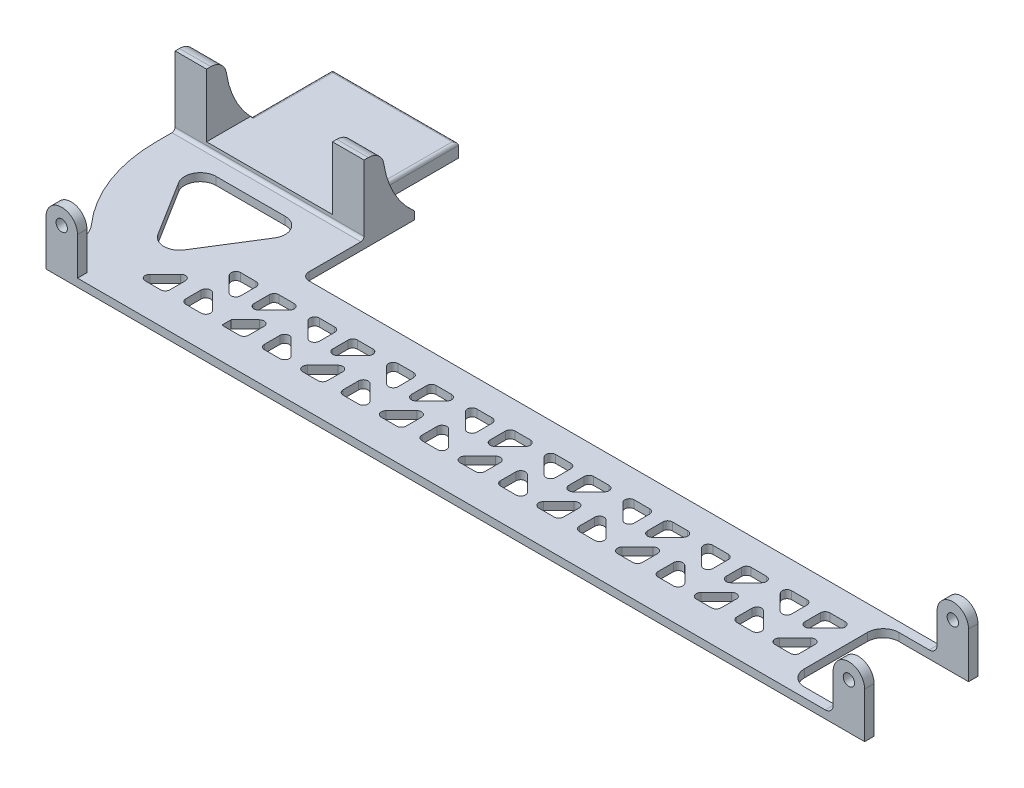
from build123d import *

# Parameters (mm, degrees)
EXTRUDE_2_DEPTH           = 18
SKETCH_3_W                = 10
SKETCH_3_H                = 16
EXTRUDE_3_DEPTH           = 22
EXTRUDE_3_2_DEPTH         = 22
CUT_EXTRUDE_2_DEPTH       = 60
FILLET_1_R                = 5
FILLET_2_R                = 5
EXTRUDE_4_DEPTH           = 2
FILLET_3_R                = 1
EXTRUDE_5_DEPTH           = 2.5
CUT_EXTRUDE_10_DEPTH      = 167.111408532
CUT_EXTRUDE_10_DEPTH_BACK = 167.111408532
FILLET_4_R                = 1
FILLET_5_R                = 2.5
FILLET_6_R                = 2.5
EXTRUDE_6_DEPTH           = 3
SKETCH_14_W               = 10
SKETCH_14_H               = 3
EXTRUDE_7_DEPTH           = 2.5
FILLET_7_R                = 10


with BuildPart() as part:
    # 草图2 → 凸台-拉伸2 (new, symmetric)
    with BuildSketch(Plane.XY):
        with BuildLine():
            ThreePointArc((130, 12), (125, 17), (120, 12))
            Line((120, 12), (123.2, 12))
            ThreePointArc((123.2, 12), (125, 13.8), (126.8, 12))
            Line((126.8, 12), (130, 12))
        make_face()
        with BuildLine():
            Line((123.2, 12), (120, 12))
            ThreePointArc((120, 12), (125, 7), (130, 12))
            Line((130, 12), (126.8, 12))
            ThreePointArc((126.8, 12), (125, 10.2), (123.2, 12))
        make_face()
        with BuildLine():
            Line((120, 12), (120, 0))
            Line((120, 0), (125, 0))
            Line((125, 0), (130, 0))
            Line((130, 0), (130, 12))
            ThreePointArc((130, 12), (125, 7), (120, 12))
        make_face()
    extrude(amount=EXTRUDE_2_DEPTH, both=True)



with BuildPart() as body_2:
    # 草图3 → 凸台-拉伸3 (new body)
    with BuildSketch(Plane(origin=(0, 0, 0), x_dir=(1, 0, 0), z_dir=(0, 1, 0))):
        with Locations((-90, 46)):
            Rectangle(SKETCH_3_W, SKETCH_3_H)
    extrude(amount=EXTRUDE_3_DEPTH)


with BuildPart() as body_3:
    # 草图3 → Extrude 3 2 (new body)
    with BuildSketch(Plane(origin=(0, 0, 0), x_dir=(1, 0, 0), z_dir=(0, 1, 0))):
        with Locations((-140, 46)):
            Rectangle(SKETCH_3_W, SKETCH_3_H)
    extrude(amount=EXTRUDE_3_2_DEPTH)


with BuildPart() as cut_extrude_2_tool:
    # 草图7 → 切除-拉伸2 (new body)
    with BuildSketch(Plane.ZY.offset(145)):
        with BuildLine():
            Line((-54, 22), (-54, 0))
            ThreePointArc((-54, 0), (-46.617298858, 9.916954026), (-44, 22))
            Line((-44, 22), (-54, 22))
        make_face()
    extrude(amount=-CUT_EXTRUDE_2_DEPTH)


with BuildPart() as body_2_1:
    add(body_2.part)

    # 切除-拉伸2: cut by cut_extrude_2_tool
    add(cut_extrude_2_tool.part, mode=Mode.SUBTRACT)

    # 圆角2
    fillet_2_edges = [body_2_1.edges().sort_by_distance(p)[0] for p in [
        (-90, 22, -44),
    ]]
    fillet(fillet_2_edges, radius=FILLET_2_R)



with BuildPart() as body_3_1:
    add(body_3.part)

    # 切除-拉伸2: cut by cut_extrude_2_tool
    add(cut_extrude_2_tool.part, mode=Mode.SUBTRACT)

    # 圆角1
    fillet_1_edges = [body_3_1.edges().sort_by_distance(p)[0] for p in [
        (-140, 22, -44),
    ]]
    fillet(fillet_1_edges, radius=FILLET_1_R)


with BuildPart() as body_2_2:
    add(body_2_1.part)

    add(body_3_1.part)  # 凸台-拉伸4 merges body 3
    # 草图10 → 凸台-拉伸4 (add)
    with BuildSketch(Plane(origin=(0, 0, 0), x_dir=(1, 0, 0), z_dir=(0, 1, 0))):
        Polygon((-95, 38), (-95, 54), (-95, 78), (-135, 78), (-135, 54), (-135, 38), align=None)
    extrude(amount=EXTRUDE_4_DEPTH)

    # 圆角3
    fillet_3_edges = [body_2_2.edges().sort_by_distance(p)[0] for p in [
        (-95, 2, -64.962331082),
        (-115, 2, -78),
        (-135, 2, -64.962331082),
    ]]
    fillet(fillet_3_edges, radius=FILLET_3_R)


with BuildPart() as part_1:
    add(part.part)

    add(body_2_2.part)  # 凸台-拉伸5 merges body 2
    # 草图11 → 凸台-拉伸5 (add)
    with BuildSketch(Plane(origin=(0, 0, 0), x_dir=(1, 0, 0), z_dir=(0, 1, 0))):
        with BuildLine():
            Line((120, -18), (-95, -18))
            ThreePointArc((-95, -18), (-130.355339059, -3.355339059), (-145, 32))
            Line((-145, 32), (-145, 38))
            Line((-145, 38), (-145, 54))
            Line((-145, 54), (-135, 54))
            Line((-135, 54), (-135, 78))
            Line((-135, 78), (-95, 78))
            Line((-95, 78), (-95, 54))
            Line((-95, 54), (-85, 54))
            Line((-85, 54), (-85, 38))
            Line((-85, 38), (-85, 18))
            Line((-85, 18), (120, 18))
            Line((120, 18), (130, 18))
            Line((130, 18), (130, -18))
            Line((130, -18), (120, -18))
        make_face()
        with BuildLine():
            Line((-104.021238208, 32), (-125.978761792, 32))
            ThreePointArc((-125.978761792, 32), (-130.351974199, 29.423842662), (-130.218753312, 24.3500053))
            Line((-130.218753312, 24.3500053), (-119.23999152, 6.783986432))
            ThreePointArc((-119.23999152, 6.783986432), (-115, 4.433981132), (-110.76000848, 6.783986432))
            Line((-110.76000848, 6.783986432), (-99.781246688, 24.3500053))
            ThreePointArc((-99.781246688, 24.3500053), (-99.648025801, 29.423842662), (-104.021238208, 32))
        make_face(mode=Mode.SUBTRACT)
        with BuildLine():
            Line((-83.5, 9.433981132), (-78.621320344, 9.433981132))
            ThreePointArc((-78.621320344, 9.433981132), (-77.235501045, 8.508006281), (-77.560660172, 6.87332096))
            Line((-77.560660172, 6.87332096), (-82.439339828, 1.994641304))
            ThreePointArc((-82.439339828, 1.994641304), (-84.074025149, 1.669482177), (-85, 3.055301476))
            Line((-85, 3.055301476), (-85, 7.933981132))
            ThreePointArc((-85, 7.933981132), (-84.560660172, 8.994641304), (-83.5, 9.433981132))
        make_face(mode=Mode.SUBTRACT)
        with BuildLine():
            Line((-83.5, -8), (-78.621320344, -8))
            ThreePointArc((-78.621320344, -8), (-77.560660172, -7.560660172), (-77.121320344, -6.5))
            Line((-77.121320344, -6.5), (-77.121320344, -1.621320344))
            ThreePointArc((-77.121320344, -1.621320344), (-78.047295195, -0.235501045), (-79.681980515, -0.560660172))
            Line((-79.681980515, -0.560660172), (-84.560660172, -5.439339828))
            ThreePointArc((-84.560660172, -5.439339828), (-84.885819299, -7.074025149), (-83.5, -8))
        make_face(mode=Mode.SUBTRACT)
        with BuildLine():
            Line((-65.742640687, -8), (-70.621320344, -8))
            ThreePointArc((-70.621320344, -8), (-71.681980515, -7.560660172), (-72.121320344, -6.5))
            Line((-72.121320344, -6.5), (-72.121320344, -1.621320344))
            ThreePointArc((-72.121320344, -1.621320344), (-71.195345492, -0.235501045), (-69.560660172, -0.560660172))
            Line((-69.560660172, -0.560660172), (-64.681980515, -5.439339828))
            ThreePointArc((-64.681980515, -5.439339828), (-64.356821388, -7.074025149), (-65.742640687, -8))
        make_face(mode=Mode.SUBTRACT)
        with BuildLine():
            Line((-64.242640687, 3.055301476), (-64.242640687, 7.933981132))
            ThreePointArc((-64.242640687, 7.933981132), (-64.681980515, 8.994641304), (-65.742640687, 9.433981132))
            Line((-65.742640687, 9.433981132), (-70.621320344, 9.433981132))
            ThreePointArc((-70.621320344, 9.433981132), (-72.007139642, 8.508006281), (-71.681980515, 6.87332096))
            Line((-71.681980515, 6.87332096), (-66.803300859, 1.994641304))
            ThreePointArc((-66.803300859, 1.994641304), (-65.168615539, 1.669482177), (-64.242640687, 3.055301476))
        make_face(mode=Mode.SUBTRACT)
        with BuildLine():
            Line((-40.742640687, 9.433981132), (-45.621320344, 9.433981132))
            ThreePointArc((-45.621320344, 9.433981132), (-47.007139642, 8.508006281), (-46.681980515, 6.87332096))
            Line((-46.681980515, 6.87332096), (-41.803300859, 1.994641304))
            ThreePointArc((-41.803300859, 1.994641304), (-40.168615539, 1.669482177), (-39.242640687, 3.055301476))
            Line((-39.242640687, 3.055301476), (-39.242640687, 7.933981132))
            ThreePointArc((-39.242640687, 7.933981132), (-39.681980515, 8.994641304), (-40.742640687, 9.433981132))
        make_face(mode=Mode.SUBTRACT)
        with BuildLine():
            Line((-44.560660172, -0.560660172), (-39.681980515, -5.439339828))
            ThreePointArc((-39.681980515, -5.439339828), (-39.356821388, -7.074025149), (-40.742640687, -8))
            Line((-40.742640687, -8), (-45.621320344, -8))
            ThreePointArc((-45.621320344, -8), (-46.681980515, -7.560660172), (-47.121320344, -6.5))
            Line((-47.121320344, -6.5), (-47.121320344, -1.621320344))
            ThreePointArc((-47.121320344, -1.621320344), (-46.195345492, -0.235501045), (-44.560660172, -0.560660172))
        make_face(mode=Mode.SUBTRACT)
        with BuildLine():
            Line((-52.560660172, 6.87332096), (-57.439339828, 1.994641304))
            ThreePointArc((-57.439339828, 1.994641304), (-59.074025149, 1.669482177), (-60, 3.055301476))
            Line((-60, 3.055301476), (-60, 7.933981132))
            ThreePointArc((-60, 7.933981132), (-59.560660172, 8.994641304), (-58.5, 9.433981132))
            Line((-58.5, 9.433981132), (-53.621320344, 9.433981132))
            ThreePointArc((-53.621320344, 9.433981132), (-52.235501045, 8.508006281), (-52.560660172, 6.87332096))
        make_face(mode=Mode.SUBTRACT)
        with BuildLine():
            Line((-54.681980515, -0.560660172), (-59.560660172, -5.439339828))
            ThreePointArc((-59.560660172, -5.439339828), (-59.885819299, -7.074025149), (-58.5, -8))
            Line((-58.5, -8), (-53.621320344, -8))
            ThreePointArc((-53.621320344, -8), (-52.560660172, -7.560660172), (-52.121320344, -6.5))
            Line((-52.121320344, -6.5), (-52.121320344, -1.621320344))
            ThreePointArc((-52.121320344, -1.621320344), (-53.047295195, -0.235501045), (-54.681980515, -0.560660172))
        make_face(mode=Mode.SUBTRACT)
        with BuildLine():
            Line((-15.742640687, 9.433981132), (-20.621320344, 9.433981132))
            ThreePointArc((-20.621320344, 9.433981132), (-22.007139642, 8.508006281), (-21.681980515, 6.87332096))
            Line((-21.681980515, 6.87332096), (-16.803300859, 1.994641304))
            ThreePointArc((-16.803300859, 1.994641304), (-15.168615539, 1.669482177), (-14.242640687, 3.055301476))
            Line((-14.242640687, 3.055301476), (-14.242640687, 7.933981132))
            ThreePointArc((-14.242640687, 7.933981132), (-14.681980515, 8.994641304), (-15.742640687, 9.433981132))
        make_face(mode=Mode.SUBTRACT)
        with BuildLine():
            Line((-19.560660172, -0.560660172), (-14.681980515, -5.439339828))
            ThreePointArc((-14.681980515, -5.439339828), (-14.356821388, -7.074025149), (-15.742640687, -8))
            Line((-15.742640687, -8), (-20.621320344, -8))
            ThreePointArc((-20.621320344, -8), (-21.681980515, -7.560660172), (-22.121320344, -6.5))
            Line((-22.121320344, -6.5), (-22.121320344, -1.621320344))
            ThreePointArc((-22.121320344, -1.621320344), (-21.195345492, -0.235501045), (-19.560660172, -0.560660172))
        make_face(mode=Mode.SUBTRACT)
        with BuildLine():
            Line((-27.560660172, 6.87332096), (-32.439339828, 1.994641304))
            ThreePointArc((-32.439339828, 1.994641304), (-34.074025149, 1.669482177), (-35, 3.055301476))
            Line((-35, 3.055301476), (-35, 7.933981132))
            ThreePointArc((-35, 7.933981132), (-34.560660172, 8.994641304), (-33.5, 9.433981132))
            Line((-33.5, 9.433981132), (-28.621320344, 9.433981132))
            ThreePointArc((-28.621320344, 9.433981132), (-27.235501045, 8.508006281), (-27.560660172, 6.87332096))
        make_face(mode=Mode.SUBTRACT)
        with BuildLine():
            Line((-29.681980515, -0.560660172), (-34.560660172, -5.439339828))
            ThreePointArc((-34.560660172, -5.439339828), (-34.885819299, -7.074025149), (-33.5, -8))
            Line((-33.5, -8), (-28.621320344, -8))
            ThreePointArc((-28.621320344, -8), (-27.560660172, -7.560660172), (-27.121320344, -6.5))
            Line((-27.121320344, -6.5), (-27.121320344, -1.621320344))
            ThreePointArc((-27.121320344, -1.621320344), (-28.047295195, -0.235501045), (-29.681980515, -0.560660172))
        make_face(mode=Mode.SUBTRACT)
        with BuildLine():
            Line((9.257359313, 9.433981132), (4.378679656, 9.433981132))
            ThreePointArc((4.378679656, 9.433981132), (2.992860358, 8.508006281), (3.318019485, 6.87332096))
            Line((3.318019485, 6.87332096), (8.196699141, 1.994641304))
            ThreePointArc((8.196699141, 1.994641304), (9.831384461, 1.669482177), (10.757359313, 3.055301476))
            Line((10.757359313, 3.055301476), (10.757359313, 7.933981132))
            ThreePointArc((10.757359313, 7.933981132), (10.318019485, 8.994641304), (9.257359313, 9.433981132))
        make_face(mode=Mode.SUBTRACT)
        with BuildLine():
            Line((5.439339828, -0.560660172), (10.318019485, -5.439339828))
            ThreePointArc((10.318019485, -5.439339828), (10.643178612, -7.074025149), (9.257359313, -8))
            Line((9.257359313, -8), (4.378679656, -8))
            ThreePointArc((4.378679656, -8), (3.318019485, -7.560660172), (2.878679656, -6.5))
            Line((2.878679656, -6.5), (2.878679656, -1.621320344))
            ThreePointArc((2.878679656, -1.621320344), (3.804654508, -0.235501045), (5.439339828, -0.560660172))
        make_face(mode=Mode.SUBTRACT)
        with BuildLine():
            Line((-2.560660172, 6.87332096), (-7.439339828, 1.994641304))
            ThreePointArc((-7.439339828, 1.994641304), (-9.074025149, 1.669482177), (-10, 3.055301476))
            Line((-10, 3.055301476), (-10, 7.933981132))
            ThreePointArc((-10, 7.933981132), (-9.560660172, 8.994641304), (-8.5, 9.433981132))
            Line((-8.5, 9.433981132), (-3.621320344, 9.433981132))
            ThreePointArc((-3.621320344, 9.433981132), (-2.235501045, 8.508006281), (-2.560660172, 6.87332096))
        make_face(mode=Mode.SUBTRACT)
        with BuildLine():
            Line((-4.681980515, -0.560660172), (-9.560660172, -5.439339828))
            ThreePointArc((-9.560660172, -5.439339828), (-9.885819299, -7.074025149), (-8.5, -8))
            Line((-8.5, -8), (-3.621320344, -8))
            ThreePointArc((-3.621320344, -8), (-2.560660172, -7.560660172), (-2.121320344, -6.5))
            Line((-2.121320344, -6.5), (-2.121320344, -1.621320344))
            ThreePointArc((-2.121320344, -1.621320344), (-3.047295195, -0.235501045), (-4.681980515, -0.560660172))
        make_face(mode=Mode.SUBTRACT)
        with BuildLine():
            Line((34.257359313, 9.433981132), (29.378679656, 9.433981132))
            ThreePointArc((29.378679656, 9.433981132), (27.992860358, 8.508006281), (28.318019485, 6.87332096))
            Line((28.318019485, 6.87332096), (33.196699141, 1.994641304))
            ThreePointArc((33.196699141, 1.994641304), (34.831384461, 1.669482177), (35.757359313, 3.055301476))
            Line((35.757359313, 3.055301476), (35.757359313, 7.933981132))
            ThreePointArc((35.757359313, 7.933981132), (35.318019485, 8.994641304), (34.257359313, 9.433981132))
        make_face(mode=Mode.SUBTRACT)
        with BuildLine():
            Line((30.439339828, -0.560660172), (35.318019485, -5.439339828))
            ThreePointArc((35.318019485, -5.439339828), (35.643178612, -7.074025149), (34.257359313, -8))
            Line((34.257359313, -8), (29.378679656, -8))
            ThreePointArc((29.378679656, -8), (28.318019485, -7.560660172), (27.878679656, -6.5))
            Line((27.878679656, -6.5), (27.878679656, -1.621320344))
            ThreePointArc((27.878679656, -1.621320344), (28.804654508, -0.235501045), (30.439339828, -0.560660172))
        make_face(mode=Mode.SUBTRACT)
        with BuildLine():
            Line((22.439339828, 6.87332096), (17.560660172, 1.994641304))
            ThreePointArc((17.560660172, 1.994641304), (15.925974851, 1.669482177), (15, 3.055301476))
            Line((15, 3.055301476), (15, 7.933981132))
            ThreePointArc((15, 7.933981132), (15.439339828, 8.994641304), (16.5, 9.433981132))
            Line((16.5, 9.433981132), (21.378679656, 9.433981132))
            ThreePointArc((21.378679656, 9.433981132), (22.764498955, 8.508006281), (22.439339828, 6.87332096))
        make_face(mode=Mode.SUBTRACT)
        with BuildLine():
            Line((20.318019485, -0.560660172), (15.439339828, -5.439339828))
            ThreePointArc((15.439339828, -5.439339828), (15.114180701, -7.074025149), (16.5, -8))
            Line((16.5, -8), (21.378679656, -8))
            ThreePointArc((21.378679656, -8), (22.439339828, -7.560660172), (22.878679656, -6.5))
            Line((22.878679656, -6.5), (22.878679656, -1.621320344))
            ThreePointArc((22.878679656, -1.621320344), (21.952704805, -0.235501045), (20.318019485, -0.560660172))
        make_face(mode=Mode.SUBTRACT)
        with BuildLine():
            Line((59.257359313, 9.433981132), (54.378679656, 9.433981132))
            ThreePointArc((54.378679656, 9.433981132), (52.992860358, 8.508006281), (53.318019485, 6.87332096))
            Line((53.318019485, 6.87332096), (58.196699141, 1.994641304))
            ThreePointArc((58.196699141, 1.994641304), (59.831384461, 1.669482177), (60.757359313, 3.055301476))
            Line((60.757359313, 3.055301476), (60.757359313, 7.933981132))
            ThreePointArc((60.757359313, 7.933981132), (60.318019485, 8.994641304), (59.257359313, 9.433981132))
        make_face(mode=Mode.SUBTRACT)
        with BuildLine():
            Line((55.439339828, -0.560660172), (60.318019485, -5.439339828))
            ThreePointArc((60.318019485, -5.439339828), (60.643178612, -7.074025149), (59.257359313, -8))
            Line((59.257359313, -8), (54.378679656, -8))
            ThreePointArc((54.378679656, -8), (53.318019485, -7.560660172), (52.878679656, -6.5))
            Line((52.878679656, -6.5), (52.878679656, -1.621320344))
            ThreePointArc((52.878679656, -1.621320344), (53.804654508, -0.235501045), (55.439339828, -0.560660172))
        make_face(mode=Mode.SUBTRACT)
        with BuildLine():
            Line((47.439339828, 6.87332096), (42.560660172, 1.994641304))
            ThreePointArc((42.560660172, 1.994641304), (40.925974851, 1.669482177), (40, 3.055301476))
            Line((40, 3.055301476), (40, 7.933981132))
            ThreePointArc((40, 7.933981132), (40.439339828, 8.994641304), (41.5, 9.433981132))
            Line((41.5, 9.433981132), (46.378679656, 9.433981132))
            ThreePointArc((46.378679656, 9.433981132), (47.764498955, 8.508006281), (47.439339828, 6.87332096))
        make_face(mode=Mode.SUBTRACT)
        with BuildLine():
            Line((45.318019485, -0.560660172), (40.439339828, -5.439339828))
            ThreePointArc((40.439339828, -5.439339828), (40.114180701, -7.074025149), (41.5, -8))
            Line((41.5, -8), (46.378679656, -8))
            ThreePointArc((46.378679656, -8), (47.439339828, -7.560660172), (47.878679656, -6.5))
            Line((47.878679656, -6.5), (47.878679656, -1.621320344))
            ThreePointArc((47.878679656, -1.621320344), (46.952704805, -0.235501045), (45.318019485, -0.560660172))
        make_face(mode=Mode.SUBTRACT)
        with BuildLine():
            Line((84.257359313, 9.433981132), (79.378679656, 9.433981132))
            ThreePointArc((79.378679656, 9.433981132), (77.992860358, 8.508006281), (78.318019485, 6.87332096))
            Line((78.318019485, 6.87332096), (83.196699141, 1.994641304))
            ThreePointArc((83.196699141, 1.994641304), (84.831384461, 1.669482177), (85.757359313, 3.055301476))
            Line((85.757359313, 3.055301476), (85.757359313, 7.933981132))
            ThreePointArc((85.757359313, 7.933981132), (85.318019485, 8.994641304), (84.257359313, 9.433981132))
        make_face(mode=Mode.SUBTRACT)
        with BuildLine():
            Line((80.439339828, -0.560660172), (85.318019485, -5.439339828))
            ThreePointArc((85.318019485, -5.439339828), (85.643178612, -7.074025149), (84.257359313, -8))
            Line((84.257359313, -8), (79.378679656, -8))
            ThreePointArc((79.378679656, -8), (78.318019485, -7.560660172), (77.878679656, -6.5))
            Line((77.878679656, -6.5), (77.878679656, -1.621320344))
            ThreePointArc((77.878679656, -1.621320344), (78.804654508, -0.235501045), (80.439339828, -0.560660172))
        make_face(mode=Mode.SUBTRACT)
        with BuildLine():
            Line((72.439339828, 6.87332096), (67.560660172, 1.994641304))
            ThreePointArc((67.560660172, 1.994641304), (65.925974851, 1.669482177), (65, 3.055301476))
            Line((65, 3.055301476), (65, 7.933981132))
            ThreePointArc((65, 7.933981132), (65.439339828, 8.994641304), (66.5, 9.433981132))
            Line((66.5, 9.433981132), (71.378679656, 9.433981132))
            ThreePointArc((71.378679656, 9.433981132), (72.764498955, 8.508006281), (72.439339828, 6.87332096))
        make_face(mode=Mode.SUBTRACT)
        with BuildLine():
            Line((70.318019485, -0.560660172), (65.439339828, -5.439339828))
            ThreePointArc((65.439339828, -5.439339828), (65.114180701, -7.074025149), (66.5, -8))
            Line((66.5, -8), (71.378679656, -8))
            ThreePointArc((71.378679656, -8), (72.439339828, -7.560660172), (72.878679656, -6.5))
            Line((72.878679656, -6.5), (72.878679656, -1.621320344))
            ThreePointArc((72.878679656, -1.621320344), (71.952704805, -0.235501045), (70.318019485, -0.560660172))
        make_face(mode=Mode.SUBTRACT)
        with BuildLine():
            Line((109.257359313, 9.433981132), (104.378679656, 9.433981132))
            ThreePointArc((104.378679656, 9.433981132), (102.992860358, 8.508006281), (103.318019485, 6.87332096))
            Line((103.318019485, 6.87332096), (108.196699141, 1.994641304))
            ThreePointArc((108.196699141, 1.994641304), (109.831384461, 1.669482177), (110.757359313, 3.055301476))
            Line((110.757359313, 3.055301476), (110.757359313, 7.933981132))
            ThreePointArc((110.757359313, 7.933981132), (110.318019485, 8.994641304), (109.257359313, 9.433981132))
        make_face(mode=Mode.SUBTRACT)
        with BuildLine():
            Line((105.439339828, -0.560660172), (110.318019485, -5.439339828))
            ThreePointArc((110.318019485, -5.439339828), (110.643178612, -7.074025149), (109.257359313, -8))
            Line((109.257359313, -8), (104.378679656, -8))
            ThreePointArc((104.378679656, -8), (103.318019485, -7.560660172), (102.878679656, -6.5))
            Line((102.878679656, -6.5), (102.878679656, -1.621320344))
            ThreePointArc((102.878679656, -1.621320344), (103.804654508, -0.235501045), (105.439339828, -0.560660172))
        make_face(mode=Mode.SUBTRACT)
        with BuildLine():
            Line((97.439339828, 6.87332096), (92.560660172, 1.994641304))
            ThreePointArc((92.560660172, 1.994641304), (90.925974851, 1.669482177), (90, 3.055301476))
            Line((90, 3.055301476), (90, 7.933981132))
            ThreePointArc((90, 7.933981132), (90.439339828, 8.994641304), (91.5, 9.433981132))
            Line((91.5, 9.433981132), (96.378679656, 9.433981132))
            ThreePointArc((96.378679656, 9.433981132), (97.764498955, 8.508006281), (97.439339828, 6.87332096))
        make_face(mode=Mode.SUBTRACT)
        with BuildLine():
            Line((95.318019485, -0.560660172), (90.439339828, -5.439339828))
            ThreePointArc((90.439339828, -5.439339828), (90.114180701, -7.074025149), (91.5, -8))
            Line((91.5, -8), (96.378679656, -8))
            ThreePointArc((96.378679656, -8), (97.439339828, -7.560660172), (97.878679656, -6.5))
            Line((97.878679656, -6.5), (97.878679656, -1.621320344))
            ThreePointArc((97.878679656, -1.621320344), (96.952704805, -0.235501045), (95.318019485, -0.560660172))
        make_face(mode=Mode.SUBTRACT)
        with BuildLine():
            Line((-90.742640687, 9.433981132), (-95.621320344, 9.433981132))
            ThreePointArc((-95.621320344, 9.433981132), (-97.007139642, 8.508006281), (-96.681980515, 6.87332096))
            Line((-96.681980515, 6.87332096), (-91.803300859, 1.994641304))
            ThreePointArc((-91.803300859, 1.994641304), (-90.168615539, 1.669482177), (-89.242640687, 3.055301476))
            Line((-89.242640687, 3.055301476), (-89.242640687, 7.933981132))
            ThreePointArc((-89.242640687, 7.933981132), (-89.681980515, 8.994641304), (-90.742640687, 9.433981132))
        make_face(mode=Mode.SUBTRACT)
        with BuildLine():
            Line((-94.560660172, -0.560660172), (-89.681980515, -5.439339828))
            ThreePointArc((-89.681980515, -5.439339828), (-89.356821388, -7.074025149), (-90.742640687, -8))
            Line((-90.742640687, -8), (-95.621320344, -8))
            ThreePointArc((-95.621320344, -8), (-96.681980515, -7.560660172), (-97.121320344, -6.5))
            Line((-97.121320344, -6.5), (-97.121320344, -1.621320344))
            ThreePointArc((-97.121320344, -1.621320344), (-96.195345492, -0.235501045), (-94.560660172, -0.560660172))
        make_face(mode=Mode.SUBTRACT)
        with BuildLine():
            Line((-108.5, -8), (-103.621320344, -8))
            ThreePointArc((-103.621320344, -8), (-102.560660172, -7.560660172), (-102.121320344, -6.5))
            Line((-102.121320344, -6.5), (-102.121320344, -1.621320344))
            ThreePointArc((-102.121320344, -1.621320344), (-103.047295195, -0.235501045), (-104.681980515, -0.560660172))
            Line((-104.681980515, -0.560660172), (-109.560660172, -5.439339828))
            ThreePointArc((-109.560660172, -5.439339828), (-109.885819299, -7.074025149), (-108.5, -8))
        make_face(mode=Mode.SUBTRACT)
    extrude(amount=-EXTRUDE_5_DEPTH)

    # 草图12 → 切除-拉伸10 (cut, two sides: drawn at the far end of the back side and taken through both)
    with BuildSketch(Plane(origin=(0, 0, 0), x_dir=(1, 0, 0), z_dir=(0, 1, 0)).offset(-CUT_EXTRUDE_10_DEPTH_BACK)):
        with BuildLine():
            Line((102.878679656, 7.933981132), (102.878679656, -1.621320344))
            ThreePointArc((102.878679656, -1.621320344), (103.804654508, -0.235501045), (105.439339828, -0.560660172))
            Line((105.439339828, -0.560660172), (110.318019485, -5.439339828))
            ThreePointArc((110.318019485, -5.439339828), (110.643178612, -7.074025149), (109.257359313, -8))
            Line((109.257359313, -8), (104.378679656, -8))
            ThreePointArc((104.378679656, -8), (103.318019485, -7.560660172), (102.878679656, -6.5))
            Line((102.878679656, -6.5), (102.878679656, -10))
            ThreePointArc((102.878679656, -10), (104.343145751, -13.535533906), (107.878679656, -15))
            Line((107.878679656, -15), (130, -15))
            Line((130, -15), (130, 15))
            Line((130, 15), (107.878679656, 15))
            ThreePointArc((107.878679656, 15), (104.343145751, 13.535533906), (102.878679656, 10))
            Line((102.878679656, 10), (102.878679656, 7.933981132))
        make_face()
        with BuildLine():
            ThreePointArc((102.878679656, 7.933981132), (103.318019485, 8.994641304), (104.378679656, 9.433981132))
            Line((104.378679656, 9.433981132), (109.257359313, 9.433981132))
            ThreePointArc((109.257359313, 9.433981132), (110.318019485, 8.994641304), (110.757359313, 7.933981132))
            Line((110.757359313, 7.933981132), (110.757359313, 3.055301476))
            ThreePointArc((110.757359313, 3.055301476), (109.831384461, 1.669482177), (108.196699141, 1.994641304))
            Line((108.196699141, 1.994641304), (103.318019485, 6.87332096))
            ThreePointArc((103.318019485, 6.87332096), (102.992860358, 7.359955984), (102.878679656, 7.933981132))
        make_face(mode=Mode.SUBTRACT)
    extrude(amount=CUT_EXTRUDE_10_DEPTH + CUT_EXTRUDE_10_DEPTH_BACK, mode=Mode.SUBTRACT)

    # 圆角4
    fillet_4_edges = [part_1.edges().sort_by_distance(p)[0] for p in [
        (-115, 0, -38),
    ]]
    fillet(fillet_4_edges, radius=FILLET_4_R)

    # 圆角5
    fillet_5_edges = [part_1.edges().sort_by_distance(p)[0] for p in [
        (120, 0, 16.5),
        (120, 0, -16.5),
    ]]
    fillet(fillet_5_edges, radius=FILLET_5_R)

    # 圆角6
    fillet_6_edges = [part_1.edges().sort_by_distance(p)[0] for p in [
        (-85, -1.25, -18),
    ]]
    fillet(fillet_6_edges, radius=FILLET_6_R)



with BuildPart() as body_2_2_1:
    # 草图13 → 凸台-拉伸6 (new body)
    with BuildSketch(Plane.XY.offset(15)):
        with BuildLine():
            Line((-130, 0), (-125, 0))
            Line((-125, 0), (-120, 0))
            Line((-120, 0), (-120, 12))
            ThreePointArc((-120, 12), (-125, 7), (-130, 12))
            Line((-130, 12), (-130, 0))
        make_face()
        with BuildLine():
            ThreePointArc((-130, 12), (-125, 7), (-120, 12))
            Line((-120, 12), (-123.2, 12))
            ThreePointArc((-123.2, 12), (-125, 10.2), (-126.8, 12))
            Line((-126.8, 12), (-130, 12))
        make_face()
        with BuildLine():
            Line((-123.2, 12), (-120, 12))
            ThreePointArc((-120, 12), (-125, 17), (-130, 12))
            Line((-130, 12), (-126.8, 12))
            ThreePointArc((-126.8, 12), (-125, 13.8), (-123.2, 12))
        make_face()
    extrude(amount=EXTRUDE_6_DEPTH)


with BuildPart() as part_2:
    add(part_1.part)

    add(body_2_2_1.part)  # 凸台-拉伸7 merges body 2 2
    # 草图14 → 凸台-拉伸7 (add)
    # profile 1 of 2: a face of its own
    with BuildSketch(Plane(origin=(0, 0, 0), x_dir=(1, 0, 0), z_dir=(0, 1, 0))):
        Polygon((-84.155987829, 1.11651665), (-84.155987829, -18), (-120, -18), (-120, -15), (-130, -15), (-130, 1.11651665), align=None)
        with BuildLine():
            ThreePointArc((-109.560660172, -5.439339828), (-109.885819299, -7.074025149), (-108.5, -8))
            Line((-108.5, -8), (-103.621320344, -8))
            ThreePointArc((-103.621320344, -8), (-102.560660172, -7.560660172), (-102.121320344, -6.5))
            Line((-102.121320344, -6.5), (-102.121320344, -1.621320344))
            ThreePointArc((-102.121320344, -1.621320344), (-103.047295195, -0.235501045), (-104.681980515, -0.560660172))
            Line((-104.681980515, -0.560660172), (-109.560660172, -5.439339828))
        make_face(mode=Mode.SUBTRACT)
        with BuildLine():
            ThreePointArc((-94.560660172, -0.560660172), (-96.195345492, -0.235501045), (-97.121320344, -1.621320344))
            Line((-97.121320344, -1.621320344), (-97.121320344, -6.5))
            ThreePointArc((-97.121320344, -6.5), (-96.681980515, -7.560660172), (-95.621320344, -8))
            Line((-95.621320344, -8), (-90.742640687, -8))
            ThreePointArc((-90.742640687, -8), (-89.356821388, -7.074025149), (-89.681980515, -5.439339828))
            Line((-89.681980515, -5.439339828), (-94.560660172, -0.560660172))
        make_face(mode=Mode.SUBTRACT)
    # profile 2 of 2: a face of its own
    with BuildSketch(Plane(origin=(0, 0, 0), x_dir=(1, 0, 0), z_dir=(0, 1, 0))):
        with Locations((-125, -16.5)):
            Rectangle(SKETCH_14_W, SKETCH_14_H)
    extrude(amount=-EXTRUDE_7_DEPTH)

    # 圆角7
    fillet_7_edges = [part_2.edges().sort_by_distance(p)[0] for p in [
        (-130, -1.25, 3.707142143),
    ]]
    fillet(fillet_7_edges, radius=FILLET_7_R)


solid = part_2.part
